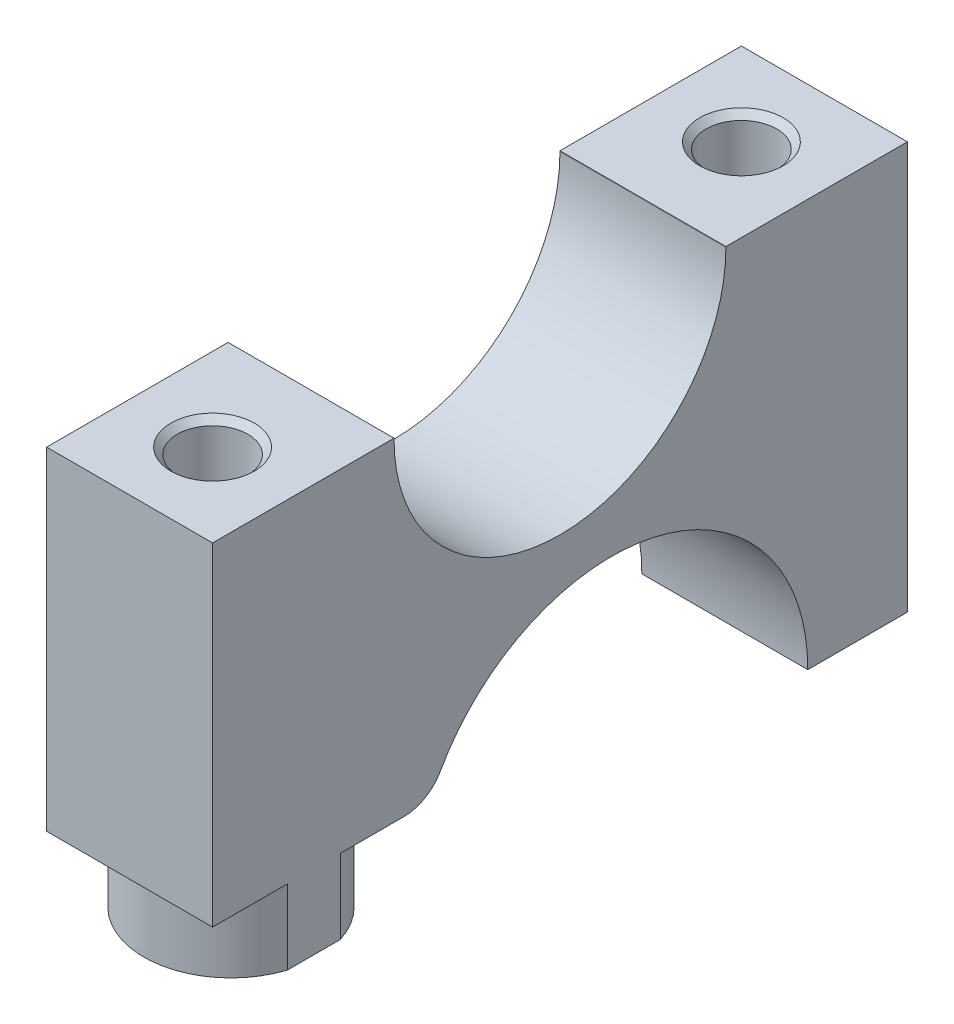
from build123d import *

# Parameters (mm, degrees)
BOSS_EXTRUDE1_DEPTH          = 20
M10_TAPPED_HOLE1_D           = 8.5
M10_TAPPED_HOLE1_DEPTH       = 27.5
M10_TAPPED_HOLE1_CSINK_D     = 10.05
M10_TAPPED_HOLE1_CSINK_ANGLE = 90
M10_TAPPED_HOLE1_TIP         = 2.553657631
M8_TAPPED_HOLE1_D            = 6.8
M8_TAPPED_HOLE1_DEPTH        = 22.25
M8_TAPPED_HOLE1_CSINK_D      = 8.05
M8_TAPPED_HOLE1_CSINK_ANGLE  = 90
M8_TAPPED_HOLE1_TIP          = 2.042926105
CUT_EXTRUDE1_DEPTH           = 72.576963501
SKETCH7_R                    = 21.448918638
SKETCH7_R_2                  = 10.5
CUT_EXTRUDE2_DEPTH           = 9
FILLET1_R                    = 5


with BuildPart() as part:
    # Sketch1 → Boss-Extrude1 (new body)
    with BuildSketch(Plane(origin=(0, 0, 0), x_dir=(0, 0, -1), z_dir=(1, 0, 0))):
        with BuildLine():
            Line((-35.65, 0), (35.65, 0))
            Line((35.65, 0), (35.65, -49.098))
            Line((35.65, -49.098), (23.65, -49.098))
            ThreePointArc((23.65, -49.098), (0, -25.448), (-23.65, -49.098))
            Line((-23.65, -49.098), (-35.65, -49.098))
            Line((-35.65, -49.098), (-48.09, -49.098))
            Line((-48.09, -49.098), (-48.09, 0))
            Line((-48.09, 0), (-35.65, 0))
        make_face()
    extrude(amount=BOSS_EXTRUDE1_DEPTH)

    # M10 Tapped Hole1
    with Locations(Plane(origin=(0, 0, 0), x_dir=(1, 0, 0), z_dir=(0, 1, 0))):
        with Locations((10, -38.09), (10, 25.65)):
            CounterSinkHole(M10_TAPPED_HOLE1_D / 2, M10_TAPPED_HOLE1_CSINK_D / 2, depth=M10_TAPPED_HOLE1_DEPTH, counter_sink_angle=M10_TAPPED_HOLE1_CSINK_ANGLE)
            with Locations((0, 0, -(M10_TAPPED_HOLE1_DEPTH + M10_TAPPED_HOLE1_TIP / 2))):  # 118° drill point
                Cone(0, M10_TAPPED_HOLE1_D / 2, M10_TAPPED_HOLE1_TIP, mode=Mode.SUBTRACT)

    # M8 Tapped Hole1
    with Locations(Plane(origin=(0, -49.098, 0), x_dir=(-1, 0, 0), z_dir=(0, -1, 0))):
        with Locations((-10, -35.87), (-10, 29.65)):
            CounterSinkHole(M8_TAPPED_HOLE1_D / 2, M8_TAPPED_HOLE1_CSINK_D / 2, depth=M8_TAPPED_HOLE1_DEPTH, counter_sink_angle=M8_TAPPED_HOLE1_CSINK_ANGLE)
            with Locations((0, 0, -(M8_TAPPED_HOLE1_DEPTH + M8_TAPPED_HOLE1_TIP / 2))):  # 118° drill point
                Cone(0, M8_TAPPED_HOLE1_D / 2, M8_TAPPED_HOLE1_TIP, mode=Mode.SUBTRACT)

    # Sketch6 → Cut-Extrude1 (cut, through all)
    with BuildSketch(Plane(origin=(20, 0, 0), x_dir=(0, 0, -1), z_dir=(1, 0, 0))):
        with BuildLine():
            Line((13.78, 0.1), (13.78, -0.1))
            ThreePointArc((13.78, -0.1), (-6.22, -20.1), (-26.22, -0.1))
            Line((-26.22, -0.1), (-26.22, 0.1))
            ThreePointArc((-26.22, 0.1), (-6.22, 20.1), (13.78, 0.1))
        make_face()
    extrude(amount=-CUT_EXTRUDE1_DEPTH, mode=Mode.SUBTRACT)

    # Sketch7 → Cut-Extrude2 (cut)
    with BuildSketch(Plane.XZ.offset(49.098)):
        with Locations((10, 35.87)):
            Circle(SKETCH7_R)
        with Locations((10, 35.87)):
            Circle(SKETCH7_R_2, mode=Mode.SUBTRACT)
    extrude(amount=-CUT_EXTRUDE2_DEPTH, mode=Mode.SUBTRACT)

    # Fillet1
    fillet1_edges = [part.edges().sort_by_distance(p)[0] for p in [
        (10, -40.098, 21.870585269),
    ]]
    fillet(fillet1_edges, radius=FILLET1_R)


solid = part.part
